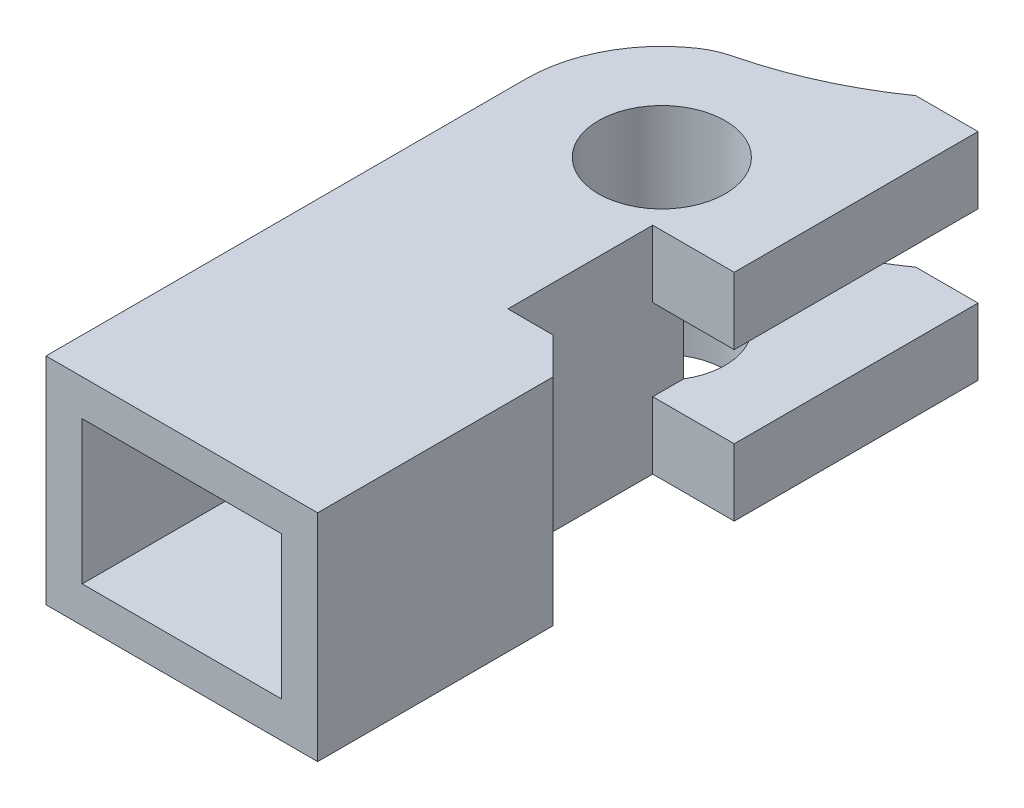
from build123d import *

# Parameters (mm, degrees)
SKETCH3_R               = 3.5
BOSS_EXTRUDE2_DEPTH     = 11.9
CUT_EXTRUDE1_REACH      = 34.374
SKETCH4_W               = 9
SKETCH4_H               = 4.5
SKETCH5_W               = 15
SKETCH5_H               = 11.9
SKETCH5_W_2             = 11
SKETCH5_H_2             = 7.9
BOSS_EXTRUDE3_DEPTH     = 10
CUT_EXTRUDE2_DEPTH      = 33.694142686
CUT_EXTRUDE2_DEPTH_BACK = 33.694142686
SKETCH6_W               = 2.7
SKETCH6_H               = 11.9
CUT_EXTRUDE3_DEPTH      = 31.002615985
CUT_EXTRUDE3_DEPTH_BACK = 31.002615985
FILLET1_R               = 4
CHAMFER1_SIZE           = 2


with BuildPart() as part:
    # Sketch3 → Boss-Extrude2 (new body)
    with BuildSketch(Plane(origin=(0, 0, 0), x_dir=(1, 0, 0), z_dir=(0, 1, 0))):
        with BuildLine():
            Line((7.5, 0), (7.5, 12.657479881))
            Line((7.5, 12.657479881), (4.816081625, 12.657479881))
            ThreePointArc((4.816081625, 12.657479881), (1.359085459, 11.744283435), (-1.195934532, 9.242959169))
            ThreePointArc((-1.195934532, 9.242959169), (-2.208037755, 7.848359435), (-3.45353313, 6.657560283))
            ThreePointArc((-3.45353313, 6.657560283), (-6.40903653, 3.895414068), (-7.5, 0))
            Line((-7.5, 0), (-7.5, -16.500886135))
            Line((-7.5, -16.500886135), (7.5, -16.500886135))
            Line((7.5, -16.500886135), (7.5, -11.500886135))
            Line((7.5, -11.500886135), (3, -11.500886135))
            Line((3, -11.500886135), (3, -3.500886135))
            Line((3, -3.500886135), (7.5, -3.500886135))
            Line((7.5, -3.500886135), (7.5, 0))
        make_face()
        with Locations(Location((0, 0, 0), (0, 0, 270))):
            Circle(SKETCH3_R, mode=Mode.SUBTRACT)
    extrude(amount=BOSS_EXTRUDE2_DEPTH)

    # Cut-Extrude1: up to this face of the body (flat: up to its plane)
    cut_extrude1_end = Plane(part.part.faces().sort_by_distance((5.25, 5.95, 3.500886135))[0])
    # Sketch4 → Cut-Extrude1 (cut, up to the picked face)
    with BuildSketch(Plane(origin=(0, 0, -12.657479881), x_dir=(-1, 0, 0), z_dir=(0, 0, -1)), mode=Mode.PRIVATE) as cut_extrude1_sk1:
        with Locations((-7.5, 5.95)):
            Rectangle(SKETCH4_W, SKETCH4_H)
    cut_extrude1_tool1 = split(extrude(cut_extrude1_sk1.sketch, amount=-CUT_EXTRUDE1_REACH, mode=Mode.PRIVATE), bisect_by=cut_extrude1_end, keep=Keep.BOTH, mode=Mode.PRIVATE)
    add(cut_extrude1_tool1.solids().sort_by(Axis((7.5, 5.95, -12.65748), (0, 0, 1)))[0], mode=Mode.SUBTRACT)

    # Sketch5 → Boss-Extrude3 (add)
    with BuildSketch(Plane.XY.offset(16.500886135)):
        with Locations((0, 5.95)):
            Rectangle(SKETCH5_W, SKETCH5_H)
        with Locations((0, 5.95)):
            Rectangle(SKETCH5_W_2, SKETCH5_H_2, mode=Mode.SUBTRACT)
    extrude(amount=BOSS_EXTRUDE3_DEPTH)

    # Sketch6 → Cut-Extrude2 (cut, two sides: drawn at the far end of the back side and taken through both)
    with BuildSketch(Plane(origin=(7.5, 0, 0), x_dir=(0, 0, -1), z_dir=(1, 0, 0)).offset(-CUT_EXTRUDE2_DEPTH_BACK)):
        with Locations((11.307479881, 5.95)):
            Rectangle(SKETCH6_W, SKETCH6_H)
    extrude(amount=CUT_EXTRUDE2_DEPTH + CUT_EXTRUDE2_DEPTH_BACK, mode=Mode.SUBTRACT)

    # Sketch7 → Cut-Extrude3 (cut, two sides: drawn at the far end of the back side and taken through both)
    with BuildSketch(Plane.XZ.offset(-CUT_EXTRUDE3_DEPTH_BACK)):
        with BuildLine():
            Line((-3.45353313, -6.657560283), (-1.779949015, -9.678496559))
            Line((-1.779949015, -9.678496559), (0.471666332, -11.274565758))
            Line((0.471666332, -11.274565758), (4.067189111, -10.062167039))
            Line((4.067189111, -10.062167039), (4.067189111, -9.957479881))
            ThreePointArc((4.067189111, -9.957479881), (0.471666332, -7.931843239), (-3.45353313, -6.657560283))
        make_face()
    extrude(amount=CUT_EXTRUDE3_DEPTH + CUT_EXTRUDE3_DEPTH_BACK, mode=Mode.SUBTRACT)

    # Fillet1
    fillet1_edges = [part.edges().sort_by_distance(p)[0] for p in [
        (-3.45353313, 5.95, -6.657560283),
    ]]
    fillet(fillet1_edges, radius=FILLET1_R)

    # Chamfer1
    chamfer1_edges = [part.edges().sort_by_distance(p)[0] for p in [
        (7.5, 5.95, 11.500886135),
    ]]
    chamfer(chamfer1_edges, length=CHAMFER1_SIZE)


solid = part.part
